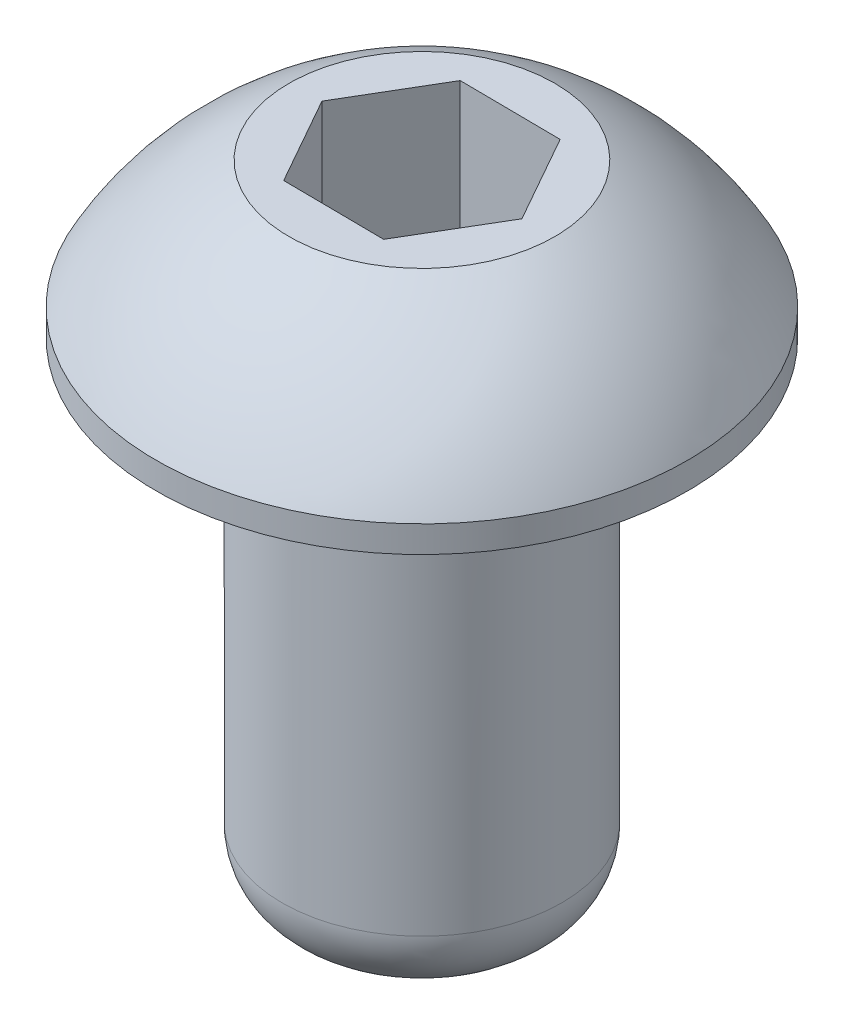
from build123d import *

# Parameters (mm, degrees)
SKETCH1_R           = 2
BOSS_EXTRUDE1_DEPTH = 7
CUT_EXTRUDE1_DEPTH  = 2
FILLET1_R           = 1


with BuildPart() as part:
    # Sketch1 → Boss-Extrude1 (new body)
    with BuildSketch(Plane(origin=(0, 0, 0), x_dir=(1, 0, 0), z_dir=(0, 1, 0))):
        with Locations(Location((0, 0, 0), (0, 0, 270))):
            Circle(SKETCH1_R)
    extrude(amount=BOSS_EXTRUDE1_DEPTH)

    # Sketch2 → Revolve1 (revolve)
    with BuildSketch(Plane.XY, mode=Mode.PRIVATE) as revolve1_sk:
        with BuildLine():
            Line((0, 7), (3.8, 7))
            Line((3.8, 7), (3.8, 7.38))
            ThreePointArc((3.8, 7.38), (2.991926525, 8.438165054), (1.9, 9.2))
            Line((1.9, 9.2), (0, 9.2))
            Line((0, 9.2), (0, 7))
        make_face()
    revolve(revolve1_sk.sketch.rotate(Axis((0, 7, 0), (0, 1, 0)), 90), axis=Axis((0, 7, 0), (0, 1, 0)))

    # Sketch3 → Cut-Extrude1 (cut)
    with BuildSketch(Plane(origin=(0, 9.2, 0), x_dir=(1, 0, 0), z_dir=(0, 1, 0))):
        Polygon((-0.73360086, -1.243045901), (0.709708899, -1.256839931), (1.443309758, -0.01379403), (0.73360086, 1.243045901), (-0.709708899, 1.256839931), (-1.443309758, 0.01379403), align=None)
    extrude(amount=-CUT_EXTRUDE1_DEPTH, mode=Mode.SUBTRACT)

    # Fillet1
    fillet1_edges = [part.edges().sort_by_distance(p)[0] for p in [
        (0, 0, -2),
        (0, 7, -2),
    ]]
    fillet(fillet1_edges, radius=FILLET1_R)


solid = part.part
